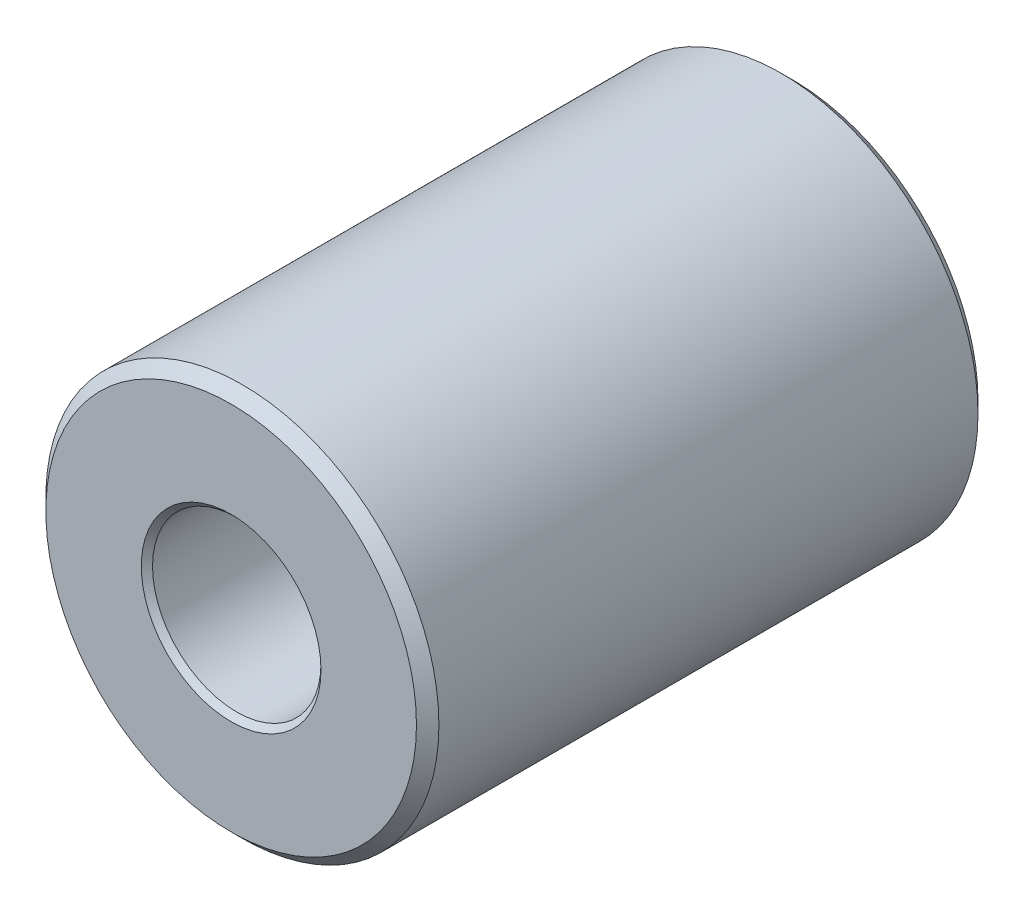
from build123d import *

# Parameters (mm, degrees)
SKETCH2_R           = 3.5
BOSS_EXTRUDE1_DEPTH = 10
SKETCH3_R           = 1.5
CUT_EXTRUDE1_DEPTH  = 10
CHAMFER1_SIZE       = 0.2
CHAMFER2_SIZE       = 0.1


with BuildPart() as part:
    # Sketch2 → Boss-Extrude1 (new body)
    with BuildSketch(Plane.XY):
        with Locations((6.092427376, -11.118651223)):
            Circle(SKETCH2_R)
    extrude(amount=BOSS_EXTRUDE1_DEPTH)

    # Sketch3 → Cut-Extrude1 (cut)
    with BuildSketch(Plane.XY.offset(10)):
        with Locations((6.092427376, -11.118651223)):
            Circle(SKETCH3_R)
    extrude(amount=-CUT_EXTRUDE1_DEPTH, mode=Mode.SUBTRACT)

    # Chamfer1
    chamfer1_edges = [part.edges().sort_by_distance(p)[0] for p in [
        (2.592427376, -11.118651223, 0),
        (2.592427376, -11.118651223, 10),
    ]]
    chamfer(chamfer1_edges, length=CHAMFER1_SIZE)

    # Chamfer2
    chamfer2_edges = [part.edges().sort_by_distance(p)[0] for p in [
        (4.592427376, -11.118651223, 0),
        (4.592427376, -11.118651223, 10),
    ]]
    chamfer(chamfer2_edges, length=CHAMFER2_SIZE)


solid = part.part
